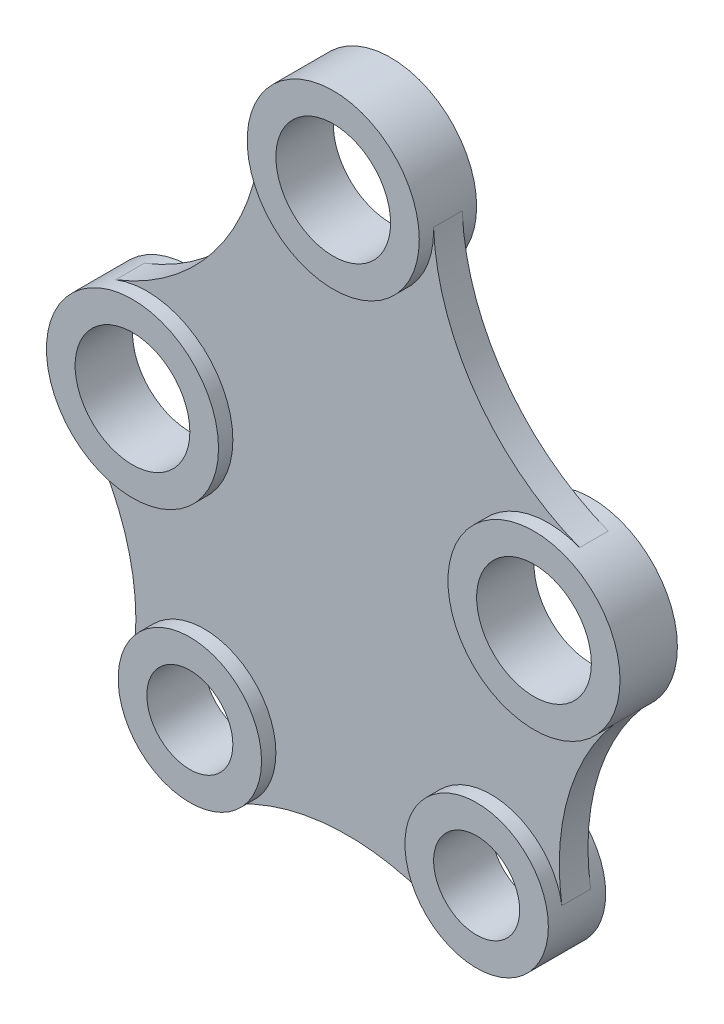
from build123d import *

# Parameters (mm, degrees)
BOSS_EXTRUDE1_DEPTH = 5
SKETCH1_3_R         = 30
SKETCH1_3_R_2       = 20
SKETCH1_3_R_3       = 25
SKETCH1_3_R_4       = 15
BOSS_EXTRUDE2_DEPTH = 10


with BuildPart() as part:
    # Sketch1 → Boss-Extrude1 (new, symmetric)
    with BuildSketch(Plane.XY):
        with BuildLine():
            ThreePointArc((30, 98), (21.213203436, 76.786796564), (0, 68))
            ThreePointArc((0, 68), (-21.643279891, 77.22577473), (-29.974824802, 99.228770963))
            ThreePointArc((-29.974824802, 99.228770963), (-44.809013245, 56.006438032), (-80.883915711, 27.95604369))
            ThreePointArc((-80.883915711, 27.95604369), (-53.066563718, 24.764061373), (-40, 0))
            ThreePointArc((-40, 0), (-59.649329868, -28.157834217), (-92.857575187, -19.430163575))
            ThreePointArc((-92.857575187, -19.430163575), (-76.859583983, -49.370140698), (-74.716930719, -83.248555502))
            ThreePointArc((-74.716930719, -83.248555502), (-48.118945506, -62.070867765), (-25, -87))
            ThreePointArc((-25, -87), (-28.521882675, -99.794157893), (-38.095238095, -108.983553944))
            ThreePointArc((-38.095238095, -108.983553944), (0, -99.330926563), (38.095238095, -108.983553944))
            ThreePointArc((38.095238095, -108.983553944), (35.626049477, -66.54542725), (74.716930719, -83.248555502))
            ThreePointArc((74.716930719, -83.248555502), (76.859583983, -49.370140698), (92.857575187, -19.430163575))
            ThreePointArc((92.857575187, -19.430163575), (40.914175072, -7.349475372), (80.883915711, 27.95604369))
            ThreePointArc((80.883915711, 27.95604369), (44.809013245, 56.006438032), (29.974824802, 99.228770963))
            ThreePointArc((29.974824802, 99.228770963), (29.99370554, 98.614514416), (30, 98))
        make_face()
    extrude(amount=BOSS_EXTRUDE1_DEPTH, both=True)

    # Sketch1<3> → Boss-Extrude2 (add, symmetric)
    # profile 1 of 5: a face of its own
    with BuildSketch(Plane.XY):
        with Locations((0, 98)):
            Circle(SKETCH1_3_R)
        with Locations((0, 98)):
            Circle(SKETCH1_3_R_2, mode=Mode.SUBTRACT)
    # profile 2 of 5: a face of its own
    with BuildSketch(Plane.XY):
        with Locations((-70, 0)):
            Circle(SKETCH1_3_R)
        with Locations((-70, 0)):
            Circle(SKETCH1_3_R_2, mode=Mode.SUBTRACT)
    # profile 3 of 5: a face of its own
    with BuildSketch(Plane.XY):
        with Locations((70, 0)):
            Circle(SKETCH1_3_R)
        with Locations((70, 0)):
            Circle(SKETCH1_3_R_2, mode=Mode.SUBTRACT)
    # profile 4 of 5: a face of its own
    with BuildSketch(Plane.XY):
        with Locations((-50, -87)):
            Circle(SKETCH1_3_R_3)
        with Locations((-50, -87)):
            Circle(SKETCH1_3_R_4, mode=Mode.SUBTRACT)
    # profile 5 of 5: a face of its own
    with BuildSketch(Plane.XY):
        with Locations((50, -87)):
            Circle(SKETCH1_3_R_3)
        with Locations((50, -87)):
            Circle(SKETCH1_3_R_4, mode=Mode.SUBTRACT)
    extrude(amount=BOSS_EXTRUDE2_DEPTH, both=True)


solid = part.part
